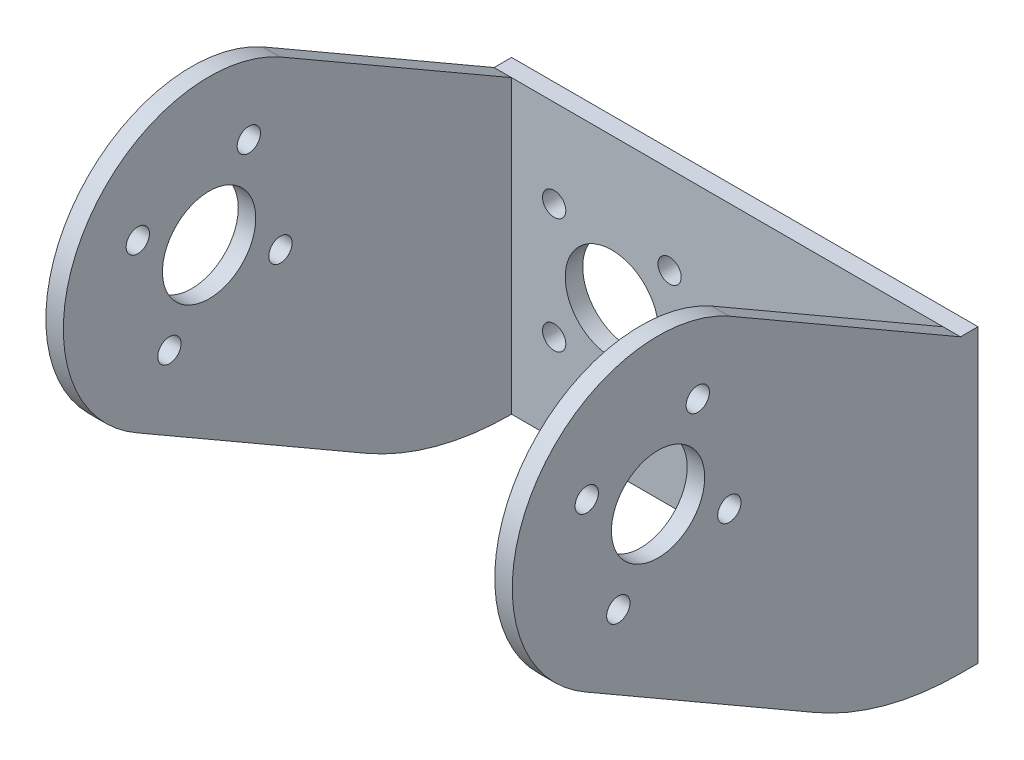
from build123d import *

# Parameters (mm, degrees)
SKETCH3_W           = 40
SKETCH3_H           = 1.5
BOSS_EXTRUDE3_DEPTH = 25
SKETCH4_R           = 4
SKETCH4_R_2         = 1
BOSS_EXTRUDE4_DEPTH = 1.5
SKETCH6_R           = 4
SKETCH6_R_2         = 1
CUT_EXTRUDE1_DEPTH  = 1.5


with BuildPart() as part:
    # Sketch3 → Boss-Extrude3 (new body)
    with BuildSketch(Plane(origin=(0, 0, 0), x_dir=(1, 0, 0), z_dir=(0, 1, 0))):
        with Locations((3.172638191, -0.75)):
            Rectangle(SKETCH3_W, SKETCH3_H)
    extrude(amount=BOSS_EXTRUDE3_DEPTH)

    # Sketch4 → Boss-Extrude4 (add)
    with BuildSketch(Plane(origin=(23.172638191, 0, 0), x_dir=(0, 0, -1), z_dir=(1, 0, 0))):
        with BuildLine():
            Line((-14, 3.349364905), (-33.522182008, 14.620501943))
            ThreePointArc((-33.522182008, 14.620501943), (-38.360080348, 31.625461179), (-21.355121112, 36.463359519))
            Line((-21.355121112, 36.463359519), (-1.5, 25))
            Line((-1.5, 25), (-1.5, 0))
            ThreePointArc((-1.5, 0), (-7.970476128, 0.851854343), (-14, 3.349364905))
        make_face()
        with Locations((-27.43865156, 25.541930731)):
            Circle(SKETCH4_R, mode=Mode.SUBTRACT)
        with Locations((-30.84502587, 19.426653627)):
            Circle(SKETCH4_R_2, mode=Mode.SUBTRACT)
        with Locations((-33.553928663, 28.948305041)):
            Circle(SKETCH4_R_2, mode=Mode.SUBTRACT)
        with Locations((-24.032277249, 31.657207834)):
            Circle(SKETCH4_R_2, mode=Mode.SUBTRACT)
        with Locations((-21.323374456, 22.13555642)):
            Circle(SKETCH4_R_2, mode=Mode.SUBTRACT)
    boss_extrude4 = extrude(amount=-BOSS_EXTRUDE4_DEPTH)

    # Mirror1: Boss-Extrude4 across plane
    add(boss_extrude4.mirror(Plane.ZY.offset(-3.172638191)))

    # Sketch6 → Cut-Extrude1 (cut)
    with BuildSketch(Plane(origin=(0, 0, 0), x_dir=(-1, 0, 0), z_dir=(0, 0, -1))):
        with Locations((-3.172638191, 12.5)):
            Circle(SKETCH6_R)
        with Locations((-13.072133128, 12.5)):
            Circle(SKETCH6_R)
        with Locations((-8.12238566, 7.550252532)):
            Circle(SKETCH6_R_2)
        with Locations((-18.021880596, 7.550252532)):
            Circle(SKETCH6_R_2)
        with Locations((-18.021880596, 17.449747468)):
            Circle(SKETCH6_R_2)
        with Locations((-8.12238566, 17.449747468)):
            Circle(SKETCH6_R_2)
        with Locations(Location((11.676604214, 17.449747468, 0), (0, 0, 180))):
            Circle(SKETCH6_R_2)
        with Locations(Location((1.777109277, 17.449747468, 0), (0, 0, 180))):
            Circle(SKETCH6_R_2)
        with Locations(Location((11.676604214, 7.550252532, 0), (0, 0, 180))):
            Circle(SKETCH6_R_2)
        with Locations(Location((6.726856745, 12.5, 0), (0, 0, 180))):
            Circle(SKETCH6_R)
        with Locations(Location((1.777109277, 7.550252532, 0), (0, 0, 180))):
            Circle(SKETCH6_R_2)
    extrude(amount=-CUT_EXTRUDE1_DEPTH, mode=Mode.SUBTRACT)


solid = part.part
